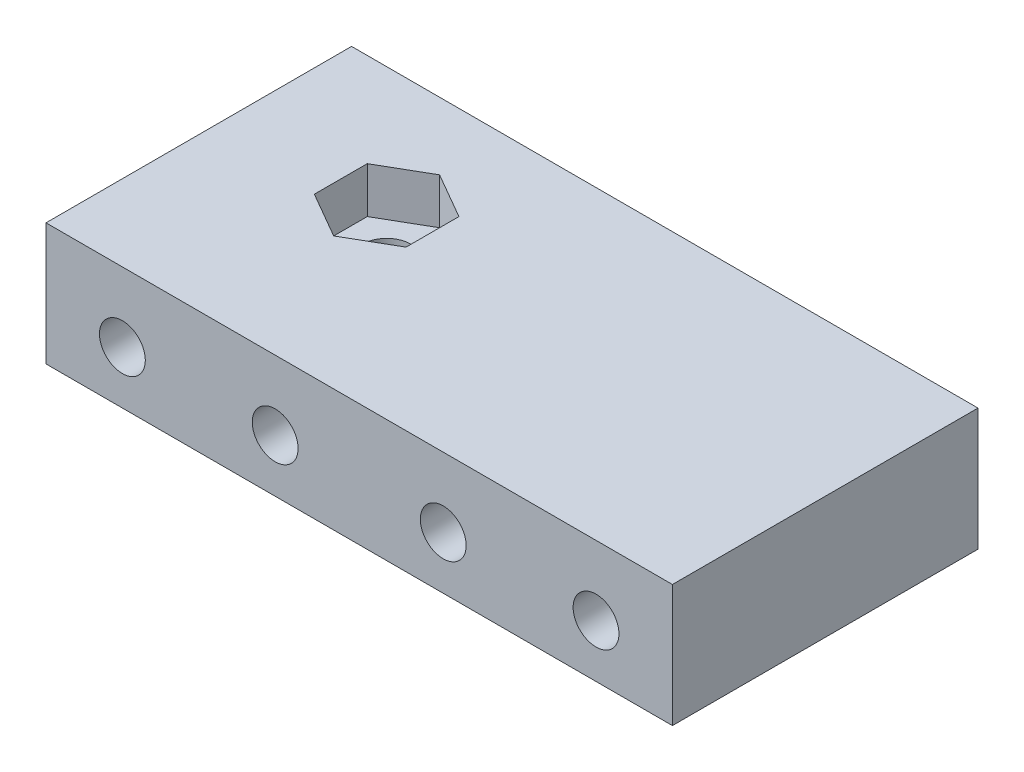
from build123d import *

# Parameters (mm, degrees)
SKETCH1_W           = 41
SKETCH1_H           = 20
BOSS_EXTRUDE1_DEPTH = 8
SKETCH2_R           = 1.5
CUT_EXTRUDE1_DEPTH  = 47.314144708
LPATTERN1_COUNT     = 2
LPATTERN1_PITCH     = 10
LPATTERN2_COUNT     = 2
LPATTERN2_PITCH     = 21
LPATTERN3_COUNT     = 2
LPATTERN3_PITCH     = 31
SKETCH3_R           = 1.6
CUT_EXTRUDE6_DEPTH  = 47.314144708
BOSS_EXTRUDE6_START = 2.5
SKETCH13_R          = 3.5
SKETCH13_R_2        = 1.6
BOSS_EXTRUDE6_DEPTH = 2.5
CUT_EXTRUDE7_DEPTH  = 3


with BuildPart() as part:
    # Sketch1 → Boss-Extrude1 (new body)
    with BuildSketch(Plane(origin=(0, 0, 0), x_dir=(1, 0, 0), z_dir=(0, 1, 0))):
        with Locations((20.5, 10)):
            Rectangle(SKETCH1_W, SKETCH1_H)
    extrude(amount=BOSS_EXTRUDE1_DEPTH)

    # Sketch2 → Cut-Extrude1 (cut, through all)
    with BuildSketch(Plane.XY):
        with Locations((5, 3.455)):
            Circle(SKETCH2_R)
    cut_extrude1 = extrude(amount=-CUT_EXTRUDE1_DEPTH, mode=Mode.SUBTRACT)

    # LPattern1: Cut-Extrude1 ×2
    with Locations(*[(i * LPATTERN1_PITCH, 0, 0) for i in range(1, LPATTERN1_COUNT)]):
        add(cut_extrude1, mode=Mode.SUBTRACT)

    # LPattern2: Cut-Extrude1 ×2
    with Locations(*[(i * LPATTERN2_PITCH, 0, 0) for i in range(1, LPATTERN2_COUNT)]):
        add(cut_extrude1, mode=Mode.SUBTRACT)

    # LPattern3: Cut-Extrude1 ×2
    with Locations(*[(i * LPATTERN3_PITCH, 0, 0) for i in range(1, LPATTERN3_COUNT)]):
        add(cut_extrude1, mode=Mode.SUBTRACT)

    # Sketch3 → Cut-Extrude6 (cut, through all)
    with BuildSketch(Plane(origin=(0, 0, 0), x_dir=(1, 0, 0), z_dir=(0, 1, 0))):
        with Locations(Location((10.16, 12.135, 0), (0, 0, 90))):
            Circle(SKETCH3_R)
    extrude(amount=CUT_EXTRUDE6_DEPTH, mode=Mode.SUBTRACT)

    # Sketch13 → Boss-Extrude6 (add)
    with BuildSketch(Plane.XZ.offset(BOSS_EXTRUDE6_START)):
        with Locations(Location((10.16, -12.135, 0), (0, 0, 270))):
            Circle(SKETCH13_R)
        with Locations(Location((10.16, -12.135, 0), (0, 0, 270))):
            Circle(SKETCH13_R_2, mode=Mode.SUBTRACT)
    extrude(amount=-BOSS_EXTRUDE6_DEPTH)

    # Sketch14 → Cut-Extrude7 (cut)
    with BuildSketch(Plane(origin=(0, 8, 0), x_dir=(1, 0, 0), z_dir=(0, 1, 0))):
        Polygon((7.16, 10.402949192), (10.16, 8.670898385), (13.16, 10.402949192), (13.16, 13.867050808), (10.16, 15.599101615), (7.16, 13.867050808), align=None)
    extrude(amount=-CUT_EXTRUDE7_DEPTH, mode=Mode.SUBTRACT)


solid = part.part
